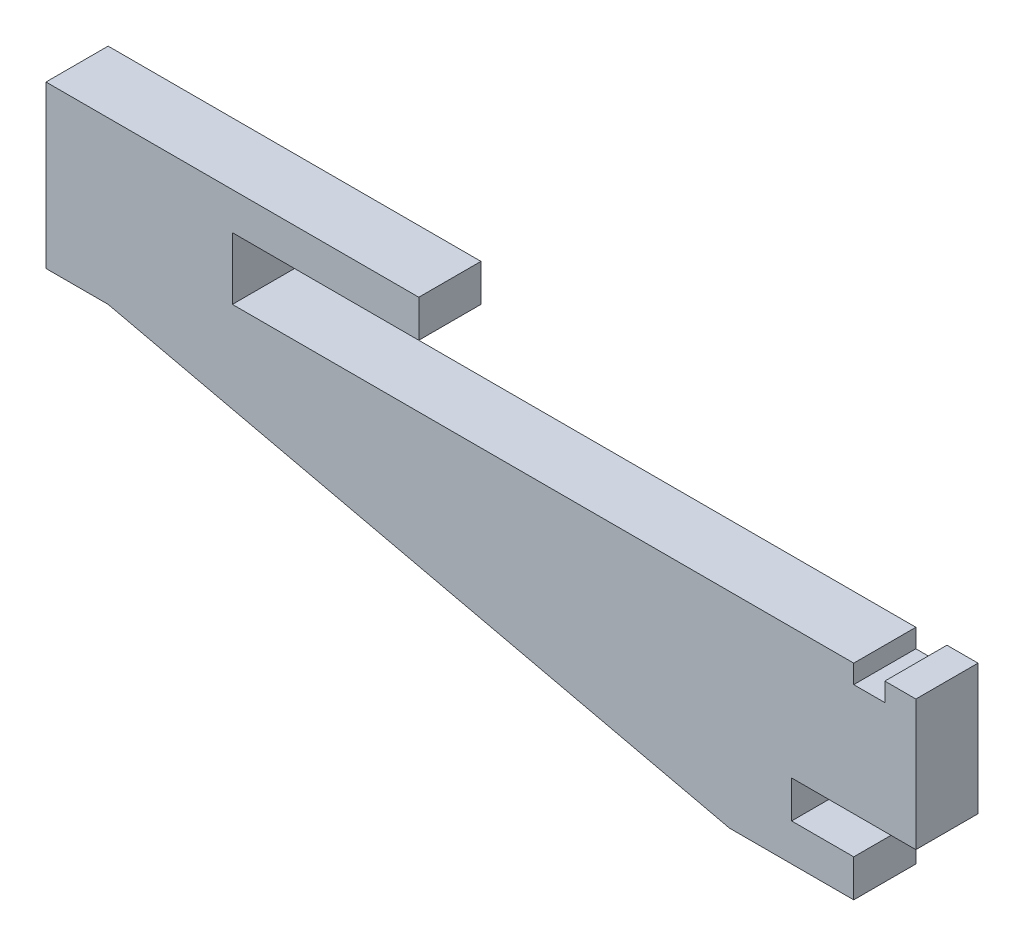
from build123d import *

# Parameters (mm, degrees)
BOSS_EXTRUDE1_DEPTH = 5
SKETCH3_W           = 2.5
SKETCH3_H           = 1.5
CUT_EXTRUDE1_DEPTH  = 172.058469536


with BuildPart() as part:
    # Sketch2 → Boss-Extrude1 (new body)
    with BuildSketch(Plane.XY.offset(-2.5)):
        Polygon((-70, -139.5), (-70, -131.5), (-40, -131.5), (-40, -134.5), (-55, -134.5), (-55, -139.5), (0, -139.5), (0, -150), (-10, -150), (-10, -153), (-5, -153), (-5, -156), (-15, -156), (-65, -144.5), (-70, -144.5), align=None)
    extrude(amount=-BOSS_EXTRUDE1_DEPTH)

    # Sketch3 → Cut-Extrude1 (cut, through all)
    with BuildSketch(Plane(origin=(0, 0, -7.5), x_dir=(-1, 0, 0), z_dir=(0, 0, -1))):
        with Locations((3.75, -140.25)):
            Rectangle(SKETCH3_W, SKETCH3_H)
    extrude(amount=-CUT_EXTRUDE1_DEPTH, mode=Mode.SUBTRACT)


solid = part.part
